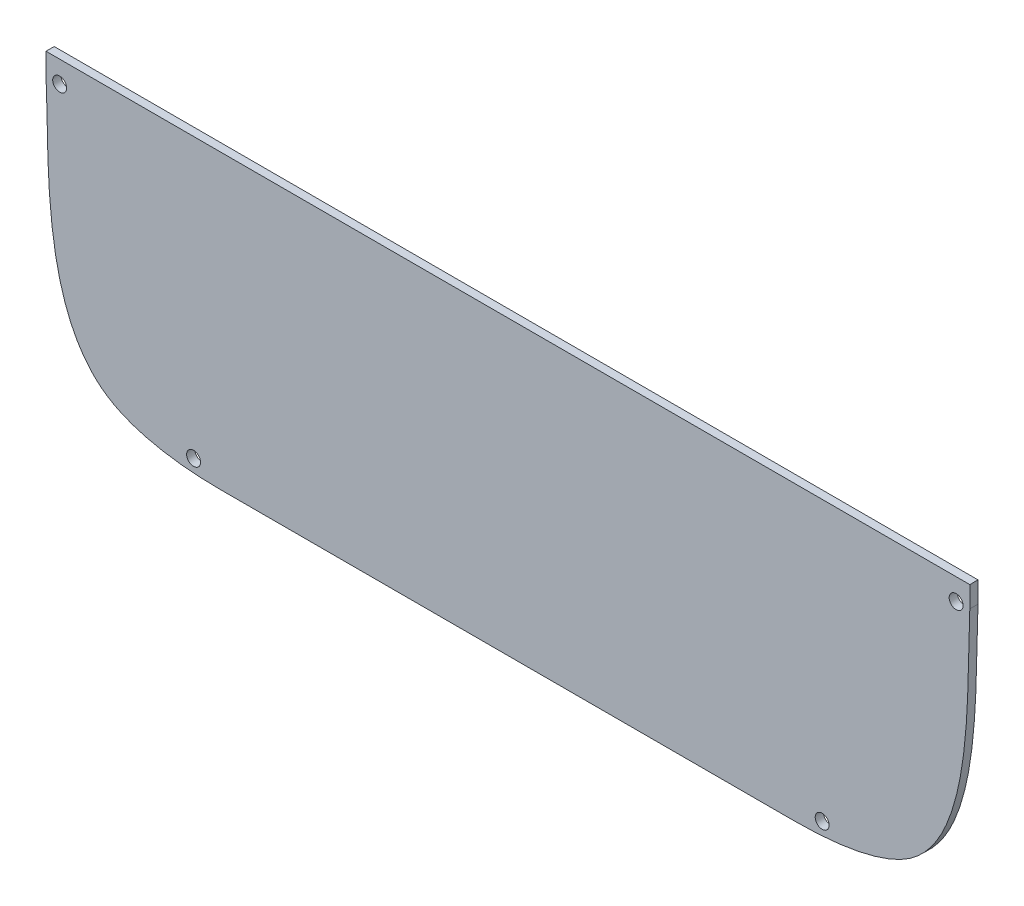
from build123d import *

# Parameters (mm, degrees)
SKETCH1_R           = 2.55
BOSS_EXTRUDE1_DEPTH = 3


with BuildPart() as part:
    # Sketch1 → Boss-Extrude1 (new body)
    with BuildSketch(Plane.XY):
        with BuildLine():
            Line((-105, -54), (100, -54))
            Line((100, -54), (105, -54))
            add(Edge.make_bspline(
                [(105, -54), (105.633650265, -54), (106.881350102, -53.992530991), (109.533261796, -53.942858593), (113.002635879, -53.806598388), (117.368936619, -53.49600414), (123.340327478, -52.849607512), (130.886920155, -51.540181374), (137.977949802, -49.415694367), (143.046435341, -47.17802551), (146.457254694, -45.240644354), (149.463967226, -43.015271385), (153.1088048, -39.588275674), (157.002885974, -34.485193361), (161.991627546, -24.682375059), (165.206606421, -12.835783475), (167.050380258, -0.044883033), (167.892991031, 9.735563334), (168.344262076, 19.431846102), (168.526520827, 27.223607092), (168.637619604, 33.160096745), (168.724670595, 37.437176727), (168.817878604, 40.827620977), (168.916739733, 43.436637469), (168.975148793, 44.683971364), (169.008250027, 45.314534983)],
                knots=[0, 0, 0, 0, 0.015625, 0.03125, 0.0625, 0.09375, 0.125, 0.1875, 0.25, 0.28125, 0.3125, 0.34375, 0.375, 0.4375, 0.5, 0.625, 0.6875, 0.75, 0.8125, 0.875, 0.90625, 0.9375, 0.96875, 0.984375, 1, 1, 1, 1], degree=3))
            Line((169.008250027, 45.314534983), (169.008250027, 53))
            Line((169.008250027, 53), (159.008250027, 53))
            Line((159.008250027, 53), (-169.008250027, 53))
            Line((-169.008250027, 53), (-169.008250027, 45.314534983))
            add(Edge.make_bspline(
                [(-169.008250027, 45.314534983), (-168.975148793, 44.683971364), (-168.916739733, 43.436637469), (-168.817878604, 40.827620977), (-168.724670595, 37.437176727), (-168.637619604, 33.160096745), (-168.526520827, 27.223607092), (-168.344262076, 19.431846102), (-167.892991031, 9.735563334), (-167.050380258, -0.044883033), (-165.206606421, -12.835783475), (-161.991627546, -24.682375059), (-157.002885974, -34.485193361), (-153.1088048, -39.588275674), (-149.463967226, -43.015271385), (-146.457254694, -45.240644354), (-143.046435341, -47.17802551), (-137.977949802, -49.415694367), (-130.886920155, -51.540181374), (-123.340327478, -52.849607512), (-117.368936619, -53.49600414), (-113.002635879, -53.806598388), (-109.533261796, -53.942858593), (-106.881350102, -53.992530991), (-105.633650265, -54), (-105, -54)],
                knots=[0, 0, 0, 0, 0.015625, 0.03125, 0.0625, 0.09375, 0.125, 0.1875, 0.25, 0.3125, 0.375, 0.5, 0.5625, 0.625, 0.65625, 0.6875, 0.71875, 0.75, 0.8125, 0.875, 0.90625, 0.9375, 0.96875, 0.984375, 1, 1, 1, 1], degree=3))
        make_face()
        with Locations((-164.008250027, 45.094493973)):
            Circle(SKETCH1_R, mode=Mode.SUBTRACT)
        with Locations((-115, -49)):
            Circle(SKETCH1_R, mode=Mode.SUBTRACT)
        with Locations((164.008250027, 45.094493973)):
            Circle(SKETCH1_R, mode=Mode.SUBTRACT)
        with Locations((115, -49)):
            Circle(SKETCH1_R, mode=Mode.SUBTRACT)
    extrude(amount=BOSS_EXTRUDE1_DEPTH)


solid = part.part
